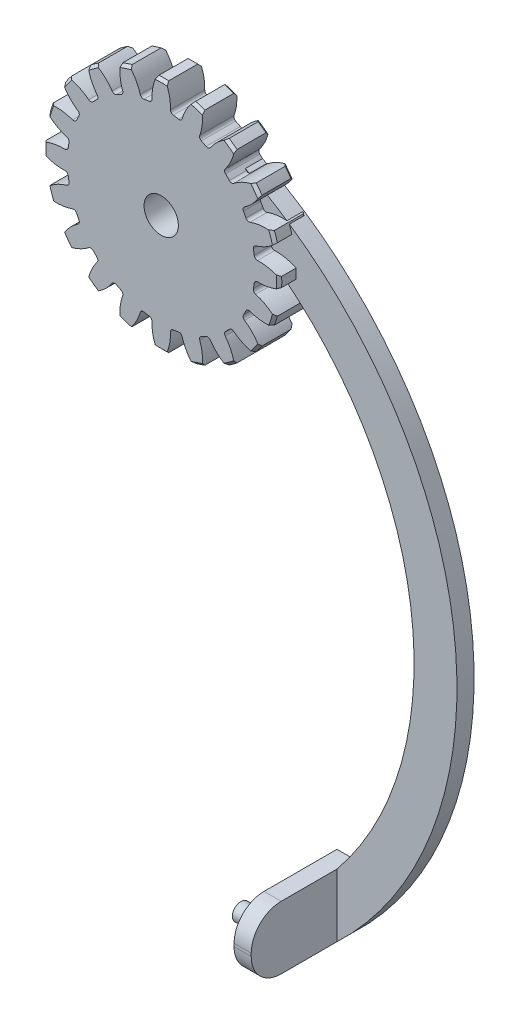
from build123d import *

# Parameters (mm, degrees)
SKETCH1_R                = 13.75
BOSS_EXTRUDE1_DEPTH      = 4
CUT_EXTRUDE4_DEPTH       = 20.852581696
FILLET1_R                = 0.375
CHAMFER1_SIZE            = 0.3125
CIRPATTERN1_COUNT        = 20
FILLET1_OF_CIRPATTERN1_R = 0.375
SKETCH4_R                = 2
CUT_EXTRUDE5_DEPTH       = 20.852581855
BOSS_EXTRUDE3_DEPTH      = 2
SKETCH8_W                = 12
SKETCH8_H                = 7.340563541
BOSS_EXTRUDE4_DEPTH      = 2
SKETCH9_R                = 1
BOSS_EXTRUDE5_DEPTH      = 3
FILLET3_R                = 3.5


with BuildPart() as part:
    # Sketch1 → Boss-Extrude1 (new body)
    with BuildSketch(Plane.XY):
        Circle(SKETCH1_R)
    extrude(amount=BOSS_EXTRUDE1_DEPTH)

    # Sketch3 → Cut-Extrude4 (cut, symmetric)
    with BuildSketch(Plane.XY):
        with BuildLine():
            ThreePointArc((-1.055847441, 10.886417796), (-1.711001961, 10.802841225), (-2.359917518, 10.679873387))
            ThreePointArc((-2.359917518, 10.679873387), (-2.861966863, 12.050796127), (-3.708097542, 13.240563153))
            ThreePointArc((-3.708097542, 13.240563153), (-2.150973894, 13.580714683), (-0.564948699, 13.738389024))
            ThreePointArc((-0.564948699, 13.738389024), (-1.002008565, 12.345384581), (-1.055847441, 10.886417796))
        make_face()
    cut_extrude4 = extrude(amount=CUT_EXTRUDE4_DEPTH, both=True, mode=Mode.SUBTRACT)

    # Fillet1
    fillet1_edges = [part.edges().sort_by_distance(p)[0] for p in [
        (-1.055847441, 10.886417796, 2),
        (-2.359917518, 10.679873387, 2),
    ]]
    fillet(fillet1_edges, radius=FILLET1_R)

    # Chamfer1
    chamfer1_edges = [part.edges().sort_by_distance(p)[0] for p in [
        (2.150973894, -13.580714683, 0),
        (2.150973894, -13.580714683, 4),
    ]]
    chamfer(chamfer1_edges, length=CHAMFER1_SIZE)

    # CirPattern1: Cut-Extrude4 ×20 about axis
    cirpattern1_axis = Axis((0, 0, 0), (0, 0, 1))
    for i in range(1, CIRPATTERN1_COUNT):
        add(cut_extrude4.rotate(cirpattern1_axis, i * 360 / CIRPATTERN1_COUNT), mode=Mode.SUBTRACT)

    # Fillet1 of CirPattern1
    fillet1_of_cirpattern1_edges = [part.edges().sort_by_distance(p)[0] for p in [
        (-4.368258696, 10.027323781, 2),
        (-5.544677308, 9.427908559, 2),
        (-7.253074354, 8.18668545, 2),
        (-8.18668545, 7.253074354, 2),
        (-9.427908559, 5.544677308, 2),
        (-10.027323781, 4.368258696, 2),
        (-10.679873387, 2.359917518, 2),
        (-10.886417796, 1.055847441, 2),
        (-10.886417796, -1.055847441, 2),
        (-10.679873387, -2.359917518, 2),
        (-10.027323781, -4.368258696, 2),
        (-9.427908559, -5.544677308, 2),
        (-8.18668545, -7.253074354, 2),
        (-7.253074354, -8.18668545, 2),
        (-5.544677308, -9.427908559, 2),
        (-4.368258696, -10.027323781, 2),
        (-2.359917518, -10.679873387, 2),
        (-1.055847441, -10.886417796, 2),
        (1.055847441, -10.886417796, 2),
        (2.359917518, -10.679873387, 2),
        (4.368258696, -10.027323781, 2),
        (5.544677308, -9.427908559, 2),
        (7.253074354, -8.18668545, 2),
        (8.18668545, -7.253074354, 2),
        (9.427908559, -5.544677308, 2),
        (10.027323781, -4.368258696, 2),
        (10.679873387, -2.359917518, 2),
        (10.886417796, -1.055847441, 2),
        (10.886417796, 1.055847441, 2),
        (10.679873387, 2.359917518, 2),
        (10.027323781, 4.368258696, 2),
        (9.427908559, 5.544677308, 2),
        (8.18668545, 7.253074354, 2),
        (7.253074354, 8.18668545, 2),
        (5.544677308, 9.427908559, 2),
        (4.368258696, 10.027323781, 2),
        (2.359917518, 10.679873387, 2),
        (1.055847441, 10.886417796, 2),
    ]]
    fillet(fillet1_of_cirpattern1_edges, radius=FILLET1_OF_CIRPATTERN1_R)

    # Sketch4 → Cut-Extrude5 (cut, through all)
    with BuildSketch(Plane.XY.offset(4)):
        Circle(SKETCH4_R)
    extrude(amount=-CUT_EXTRUDE5_DEPTH, mode=Mode.SUBTRACT)

    # Sketch7 → Boss-Extrude3 (add)
    with BuildSketch(Plane(origin=(0, 0, 0), x_dir=(-1, 0, 0), z_dir=(0, 0, -1))):
        with BuildLine():
            Line((0, 10.729041164), (0, 5.496710384))
            ThreePointArc((0, 5.496710384), (-25.892694082, -21.274981464), (-18.5, -57.77844932))
            Line((-18.5, -57.77844932), (-18.5, -65.119012861))
            ThreePointArc((-18.5, -65.119012861), (-31.218352266, -21.83671368), (0, 10.729041164))
        make_face()
    extrude(amount=-BOSS_EXTRUDE3_DEPTH)

    # Sketch8 → Boss-Extrude4 (add)
    with BuildSketch(Plane.ZY.offset(-18.5)):
        with Locations((6, -61.448731091)):
            Rectangle(SKETCH8_W, SKETCH8_H)
    extrude(amount=BOSS_EXTRUDE4_DEPTH)

    # Sketch9 → Boss-Extrude5 (add)
    with BuildSketch(Plane.ZY.offset(-16.5)):
        with Locations((8.2, -61.44873109)):
            Circle(SKETCH9_R)
    extrude(amount=BOSS_EXTRUDE5_DEPTH)

    # Fillet3
    fillet3_edges = [part.edges().sort_by_distance(p)[0] for p in [
        (17.5, -65.119012861, 12),
        (17.5, -57.77844932, 12),
    ]]
    fillet(fillet3_edges, radius=FILLET3_R)


solid = part.part
